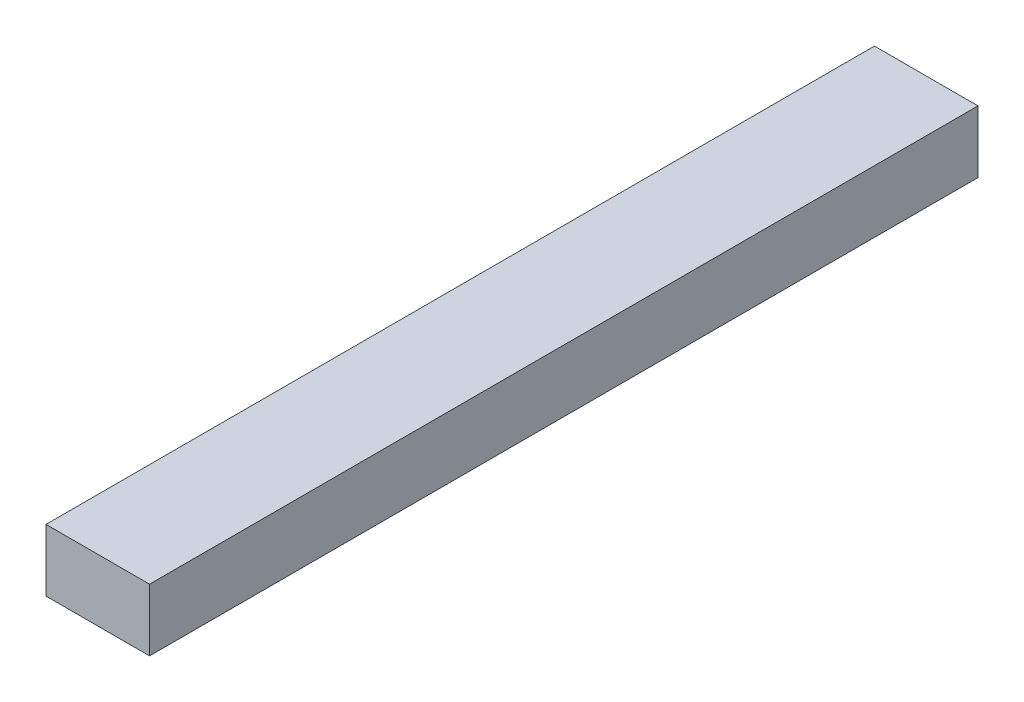
from build123d import *

# Parameters (mm, degrees)
SKIZZE1_W                       = 100
SKIZZE1_H                       = 60
AUFSATZ_LINEAR_AUSTRAGEN1_DEPTH = 800


with BuildPart() as part:
    # Skizze1 → Aufsatz-Linear austragen1 (new body)
    with BuildSketch(Plane.XY):
        Rectangle(SKIZZE1_W, SKIZZE1_H)
    extrude(amount=AUFSATZ_LINEAR_AUSTRAGEN1_DEPTH)


solid = part.part
